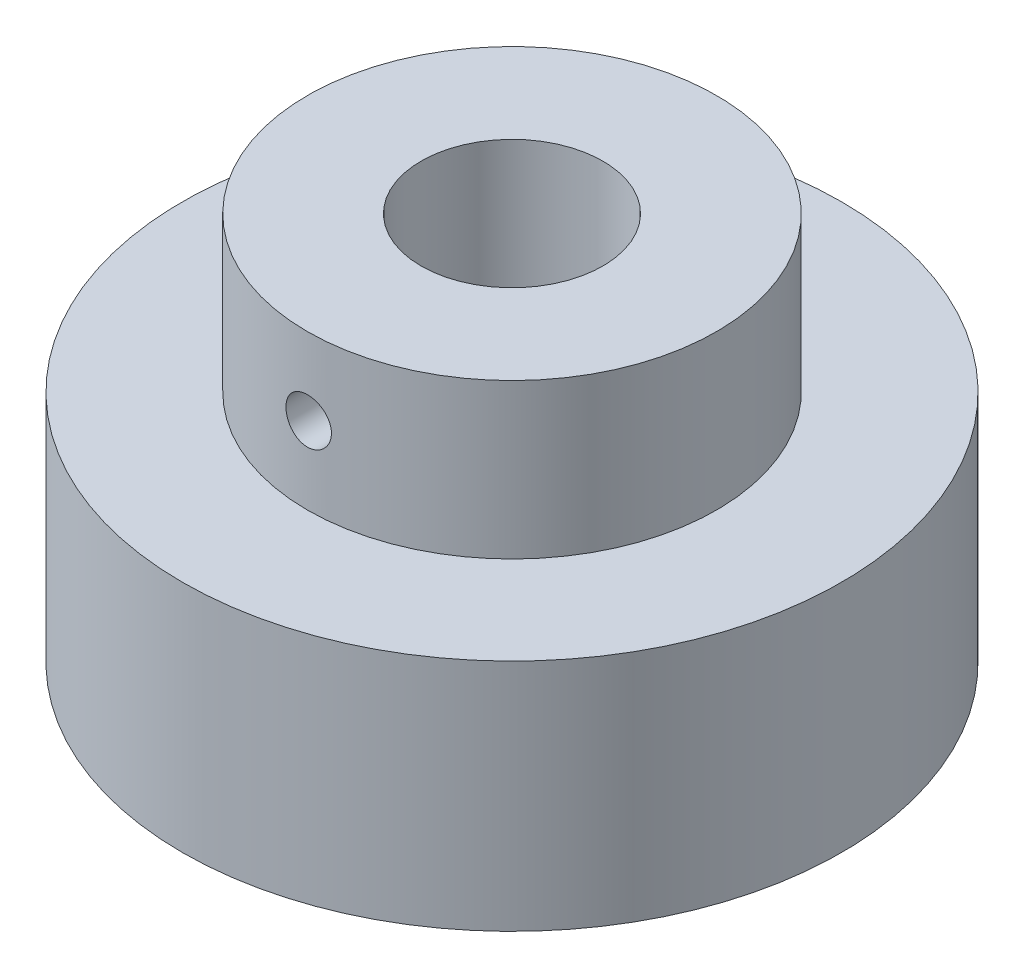
from build123d import *

# Parameters (mm, degrees)
SKETCH_1_R               = 14.5
SKETCH_1_R_2             = 4
EXTRUDE_1_DEPTH          = 10.3
SKETCH_2_R               = 9
SKETCH_2_R_2             = 4
EXTRUDE_2_DEPTH          = 6.8
CUT_EXTRUDE_1_REACH      = 28.7
CUT_EXTRUDE_1_END_RADIUS = 9
SKETCH_3_R               = 1


with BuildPart() as part:
    # 草圖1 → 填料-伸長1 (new body)
    with BuildSketch(Plane(origin=(0, 0, 0), x_dir=(1, 0, 0), z_dir=(0, 1, 0))):
        with Locations(Location((0, 0, 0), (0, 0, 90))):
            Circle(SKETCH_1_R)
        with Locations(Location((0, 0, 0), (0, 0, 90))):
            Circle(SKETCH_1_R_2, mode=Mode.SUBTRACT)
    extrude(amount=EXTRUDE_1_DEPTH)

    # 草圖2 → 填料-伸長2 (add)
    with BuildSketch(Plane(origin=(0, 10.3, 0), x_dir=(1, 0, 0), z_dir=(0, 1, 0))):
        with Locations(Location((0, 0, 0), (0, 0, 270))):
            Circle(SKETCH_2_R)
        with Locations(Location((0, 0, 0), (0, 0, 90))):
            Circle(SKETCH_2_R_2, mode=Mode.SUBTRACT)
    extrude(amount=EXTRUDE_2_DEPTH)

    # 除料-伸長1: up to this cylinder (the profile starts inside it)
    cut_extrude_1_end = Plane(origin=(0, 13.7, 0), z_dir=(0, -1, 0)) * Cylinder(CUT_EXTRUDE_1_END_RADIUS, 76.4, mode=Mode.PRIVATE)
    # 草圖3 → 除料-伸長1 (cut, up to the surface)
    with BuildSketch(Plane.XY, mode=Mode.PRIVATE) as cut_extrude_1_sk1:
        with Locations(Location((0, 13.7, 0), (0, 0, 180))):
            Circle(SKETCH_3_R)
    cut_extrude_1_tool1 = extrude(cut_extrude_1_sk1.sketch, amount=CUT_EXTRUDE_1_REACH, mode=Mode.PRIVATE) & cut_extrude_1_end
    add(cut_extrude_1_tool1.solids().sort_by_distance((0, 13.7, 0))[0], mode=Mode.SUBTRACT)


solid = part.part
